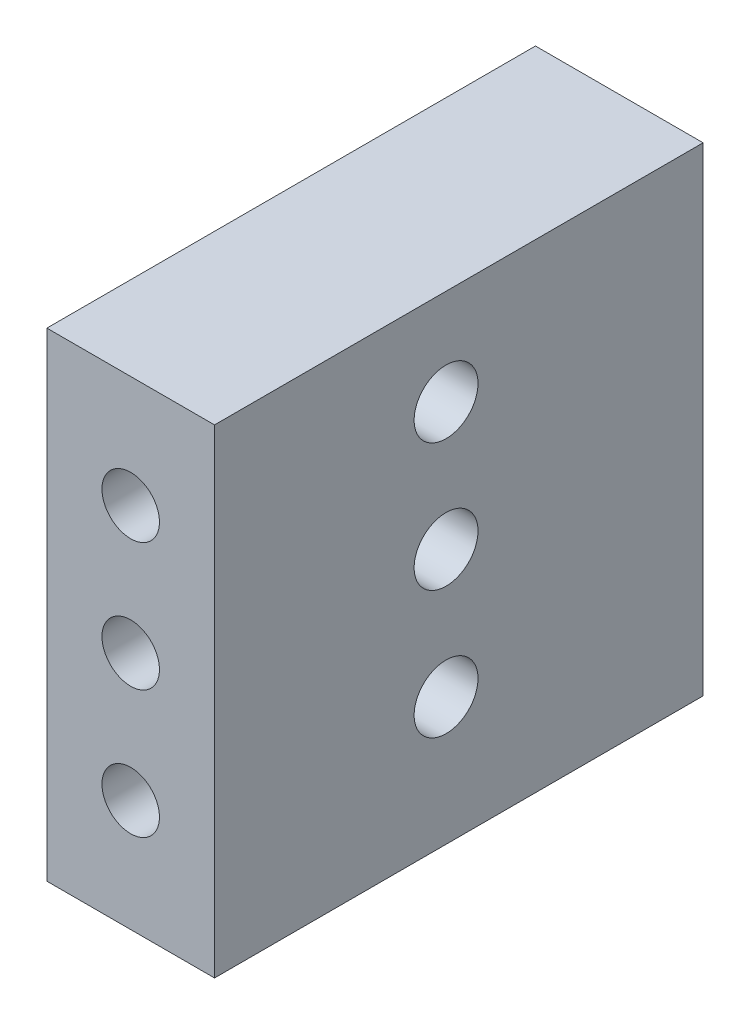
from build123d import *

# Parameters (mm, degrees)
SKETCH_1_W          = 10.5
SKETCH_1_H          = 38.1
EXTRUDE_1_DEPTH     = 30
SKETCH_2_R          = 2
CUT_EXTRUDE_1_DEPTH = 11
SKETCH_3_R          = 1.8
CUT_EXTRUDE_2_DEPTH = 17
SKETCH_4_R          = 1.8
CUT_EXTRUDE_3_DEPTH = 9
SKETCH_5_W          = 10.5
SKETCH_5_H          = 7.5
CUT_EXTRUDE_4_DEPTH = 30


with BuildPart() as part:
    # 草圖1 → 填料-伸長1 (new body)
    with BuildSketch(Plane(origin=(0, 0, 0), x_dir=(1, 0, 0), z_dir=(0, 1, 0))):
        with Locations((5.25, 19.05)):
            Rectangle(SKETCH_1_W, SKETCH_1_H)
    extrude(amount=EXTRUDE_1_DEPTH)

    # 草圖2 → 除料-伸長1 (cut)
    with BuildSketch(Plane(origin=(10.5, 0, 0), x_dir=(0, 0, -1), z_dir=(1, 0, 0))):
        with Locations((22, 24)):
            Circle(SKETCH_2_R)
        with Locations((22, 16)):
            Circle(SKETCH_2_R)
        with Locations((22, 8)):
            Circle(SKETCH_2_R)
    extrude(amount=-CUT_EXTRUDE_1_DEPTH, mode=Mode.SUBTRACT)

    # 草圖3 → 除料-伸長2 (cut)
    with BuildSketch(Plane.XY):
        with Locations((5.25, 23)):
            Circle(SKETCH_3_R)
        with Locations((5.25, 15)):
            Circle(SKETCH_3_R)
        with Locations((5.25, 7)):
            Circle(SKETCH_3_R)
    extrude(amount=-CUT_EXTRUDE_2_DEPTH, mode=Mode.SUBTRACT)

    # 草圖4 → 除料-伸長3 (cut)
    with BuildSketch(Plane(origin=(0, 0, -38.1), x_dir=(-1, 0, 0), z_dir=(0, 0, -1))):
        with Locations((-6.25, 26)):
            Circle(SKETCH_4_R)
        with Locations((-6.25, 18)):
            Circle(SKETCH_4_R)
        with Locations((-6.25, 10)):
            Circle(SKETCH_4_R)
    extrude(amount=-CUT_EXTRUDE_3_DEPTH, mode=Mode.SUBTRACT)

    # 草圖5 → 除料-伸長4 (cut)
    with BuildSketch(Plane(origin=(0, 30, 0), x_dir=(1, 0, 0), z_dir=(0, 1, 0))):
        with Locations((5.25, 3.75)):
            Rectangle(SKETCH_5_W, SKETCH_5_H)
    extrude(amount=-CUT_EXTRUDE_4_DEPTH, mode=Mode.SUBTRACT)


solid = part.part
